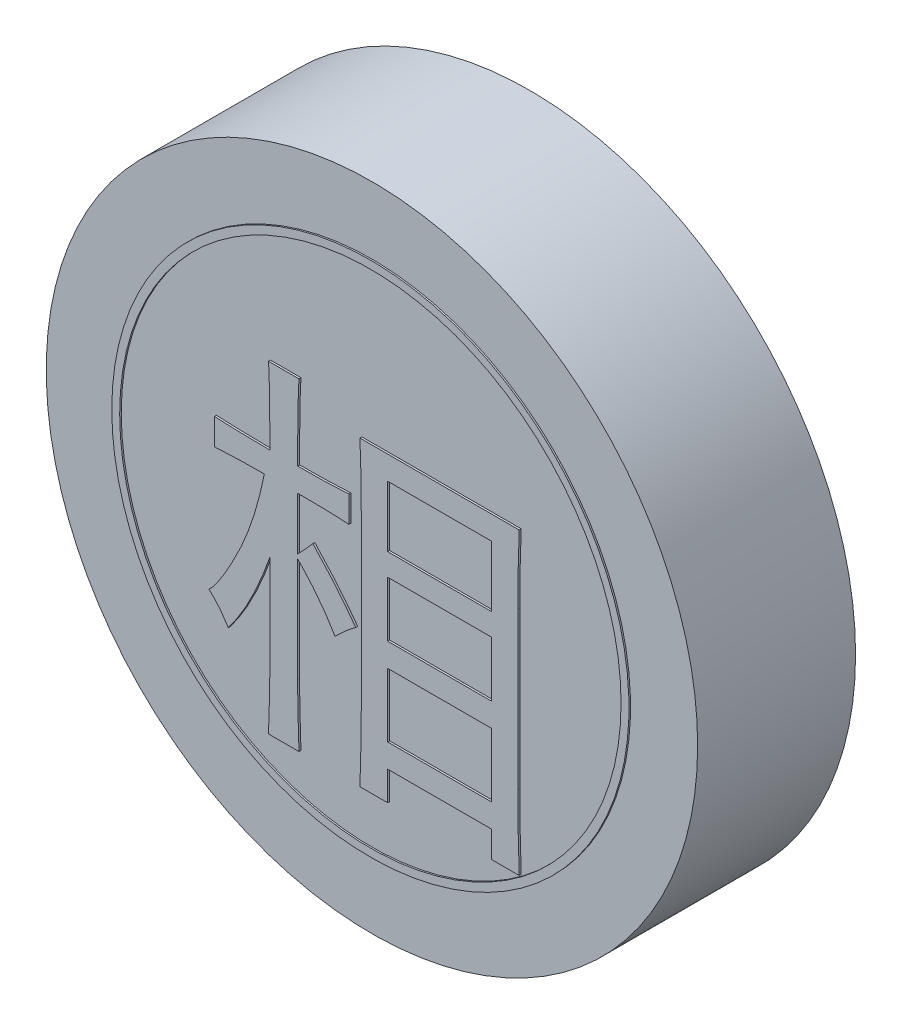
from build123d import *

# Parameters (mm, degrees)
SKETCH_1_R               = 16.5
DIAMETER33_HEIGHT8_DEPTH = 8
SKETCH_2_W               = 5.263157895
SKETCH_2_H               = 3.228070175
SKETCH_2_H_2             = 3.087719298
SKETCH_2_H_3             = 2.807017544
CHARACTER_DEPTH          = 0.1
SKETCH_3_R               = 13.1
SKETCH_3_R_2             = 12.7
INK_RING_DEPTH           = 0.08


with BuildPart() as part:
    # 草图1 → Diameter33_Height8 (new body)
    with BuildSketch(Plane.XY):
        Circle(SKETCH_1_R)
    extrude(amount=-DIAMETER33_HEIGHT8_DEPTH)

    # 草图2 → Character_相 (add)
    # profile 1 of 2: a face of its own
    with BuildSketch(Plane.XY):
        with BuildLine():
            add(Edge.make_bspline(
                [(7.561403509, 5.043859649), (7.55019112, 4.760584697), (7.527530744, 4.188082503), (7.508340227, 3.319863454), (7.49462205, 2.433550242), (7.492367, 1.83658782), (7.49122807, 1.535087719)],
                knots=[0, 0, 0, 0, 0.969283805, 1.958934606, 2.969145462, 4, 4, 4, 4], degree=3))
            Line((7.49122807, 1.535087719), (7.49122807, -6.394736842))
            add(Edge.make_bspline(
                [(7.49122807, -6.394736842), (7.494373274, -7.020306568), (7.500608133, -8.260397781), (7.541259106, -9.499836795), (7.561403509, -10.114035088)],
                knots=[0, 0, 0, 0, 1.008909215, 2, 2, 2, 2], degree=3))
            Line((7.561403509, -10.114035088), (6.157894737, -10.114035088))
            Line((6.157894737, -10.114035088), (6.157894737, -8.780701754))
            Line((6.157894737, -8.780701754), (0.894736842, -8.780701754))
            Line((0.894736842, -8.780701754), (0.894736842, -10.254385965))
            Line((0.894736842, -10.254385965), (-0.50877193, -10.254385965))
            add(Edge.make_bspline(
                [(-0.50877193, -10.254385965), (-0.497692205, -9.914790058), (-0.476326497, -9.259926631), (-0.456441705, -8.312053821), (-0.44245572, -7.435279895), (-0.439845263, -6.873840554), (-0.438596491, -6.605263158)],
                knots=[0, 0, 0, 0, 1.117081682, 2.154136505, 3.116988825, 4, 4, 4, 4], degree=3))
            Line((-0.438596491, -6.605263158), (-0.438596491, 1.605263158))
            add(Edge.make_bspline(
                [(-0.438596491, 1.605263158), (-0.439728026, 1.905030661), (-0.441958496, 2.495929231), (-0.45560045, 3.368382891), (-0.474798879, 4.214949159), (-0.497552487, 4.770115799), (-0.50877193, 5.043859649)],
                knots=[0, 0, 0, 0, 1.04583296, 2.06153501, 3.044173712, 4, 4, 4, 4], degree=3))
            Line((-0.50877193, 5.043859649), (7.561403509, 5.043859649))
        make_face()
        with Locations((3.52631579, -5.973684211)):
            Rectangle(SKETCH_2_W, SKETCH_2_H, mode=Mode.SUBTRACT)
        with Locations((3.52631579, 2.307017544)):
            Rectangle(SKETCH_2_W, SKETCH_2_H_2, mode=Mode.SUBTRACT)
        with Locations((3.52631579, -1.763157895)):
            Rectangle(SKETCH_2_W, SKETCH_2_H_3, mode=Mode.SUBTRACT)
    # profile 2 of 2: a face of its own
    with BuildSketch(Plane.XY):
        with BuildLine():
            add(Edge.make_bspline(
                [(-5.070175439, 2.236842105), (-5.069643134, 2.466430588), (-5.068622699, 2.906554508), (-5.075570455, 3.53725376), (-5.079714917, 4.10907054), (-5.087055031, 4.62111986), (-5.098673186, 5.0733128), (-5.106736303, 5.466792434), (-5.12325681, 5.801143721), (-5.135036136, 6.004664303), (-5.140350877, 6.096491228)],
                knots=[0, 0, 0, 0, 1.427178642, 2.735918853, 3.920795363, 4.981877593, 5.919216055, 6.732723881, 7.428214742, 8, 8, 8, 8], degree=3))
            Line((-5.140350877, 6.096491228), (-3.596491228, 6.096491228))
            add(Edge.make_bspline(
                [(-3.596491228, 6.096491228), (-3.601779492, 5.999464476), (-3.613344956, 5.787266417), (-3.630069425, 5.441663603), (-3.638095211, 5.041255673), (-3.649732329, 4.586464135), (-3.657106974, 4.077015184), (-3.661264203, 3.512129116), (-3.668208495, 2.892692888), (-3.667194182, 2.461232429), (-3.666666667, 2.236842105)],
                knots=[0, 0, 0, 0, 0.604055621, 1.321073082, 2.150740011, 3.093471638, 4.149178994, 5.317910599, 6.605121521, 8, 8, 8, 8], degree=3))
            add(Edge.make_bspline(
                [(-3.666666667, 2.236842105), (-3.530644111, 2.236328112), (-3.266384763, 2.235329545), (-2.88174296, 2.242348317), (-2.520442081, 2.246480446), (-2.183393026, 2.253960205), (-1.870707533, 2.265624871), (-1.582020196, 2.273807132), (-1.317912922, 2.290824228), (-1.149878443, 2.301807771), (-1.070175439, 2.307017544)],
                knots=[0, 0, 0, 0, 1.256536578, 2.441150545, 3.553740755, 4.59446206, 5.555405596, 6.444361595, 7.262121348, 8, 8, 8, 8], degree=3))
            Line((-1.070175439, 2.307017544), (-1.070175439, 0.973684211))
            add(Edge.make_bspline(
                [(-1.070175439, 0.973684211), (-1.144677854, 0.978928331), (-1.304031085, 0.990144981), (-1.556887974, 1.006935749), (-1.839513589, 1.015234756), (-2.149605268, 1.026721716), (-2.488385884, 1.034270902), (-2.855751381, 1.03840672), (-3.251657288, 1.045376401), (-3.525446035, 1.044375774), (-3.666666667, 1.043859649)],
                knots=[0, 0, 0, 0, 0.689951739, 1.475737907, 2.340680501, 3.301602752, 4.342301003, 5.470871417, 6.695471813, 8, 8, 8, 8], degree=3))
            Line((-3.666666667, 1.043859649), (-3.666666667, -1.622807018))
            add(Edge.make_bspline(
                [(-3.666666667, -1.622807018), (-3.606636203, -1.561535904), (-3.48182972, -1.434150045), (-3.293392102, -1.23182095), (-3.094864807, -1.013455465), (-2.962807273, -0.859869327), (-2.894736842, -0.780701754)],
                knots=[0, 0, 0, 0, 0.900819035, 1.872850031, 2.903538413, 4, 4, 4, 4], degree=3))
            add(Edge.make_bspline(
                [(-2.894736842, -0.780701754), (-2.689573637, -1.00021337), (-2.288105654, -1.429758644), (-1.724253911, -2.085214095), (-1.199061827, -2.727559357), (-0.877018772, -3.163628299), (-0.719298246, -3.377192982)],
                knots=[0, 0, 0, 0, 1.063555414, 2.081189198, 3.060262768, 4, 4, 4, 4], degree=3))
            add(Edge.make_bspline(
                [(-0.719298246, -3.377192982), (-0.794679109, -3.429771468), (-0.958911081, -3.544323996), (-1.205171009, -3.756414434), (-1.484543132, -4.003739185), (-1.672408418, -4.190524428), (-1.771929825, -4.289473684)],
                knots=[0, 0, 0, 0, 0.790186824, 1.721576733, 2.793008042, 4, 4, 4, 4], degree=3))
            add(Edge.make_bspline(
                [(-1.771929825, -4.289473684), (-1.904998341, -4.0700807), (-2.172035646, -3.629810433), (-2.627101337, -3.003052442), (-3.120200979, -2.3973547), (-3.483629338, -2.022250893), (-3.666666667, -1.833333333)],
                knots=[0, 0, 0, 0, 0.989574309, 1.98584356, 2.985588755, 4, 4, 4, 4], degree=3))
            Line((-3.666666667, -1.833333333), (-3.666666667, -7.166666667))
            add(Edge.make_bspline(
                [(-3.666666667, -7.166666667), (-3.66710265, -7.269767462), (-3.668003985, -7.48291384), (-3.66072287, -7.813831844), (-3.656774838, -8.166472041), (-3.648756785, -8.54161481), (-3.637317912, -8.938358747), (-3.628857904, -9.357787252), (-3.611274705, -9.798652569), (-3.601493913, -10.100167122), (-3.596491228, -10.254385965)],
                knots=[0, 0, 0, 0, 0.801096895, 1.65615505, 2.571793352, 3.541398262, 4.571731919, 5.655903347, 6.80104005, 8, 8, 8, 8], degree=3))
            Line((-3.596491228, -10.254385965), (-5.140350877, -10.254385965))
            add(Edge.make_bspline(
                [(-5.140350877, -10.254385965), (-5.135369022, -10.10016635), (-5.125684865, -9.80038102), (-5.107972861, -9.362986873), (-5.099566341, -8.949620037), (-5.088128806, -8.560674404), (-5.080093207, -8.195928707), (-5.076127742, -7.855416847), (-5.068855811, -7.538361954), (-5.069746959, -7.334744801), (-5.070175439, -7.236842105)],
                knots=[0, 0, 0, 0, 1.22682853, 2.384814657, 3.480414063, 4.514038807, 5.478633795, 6.38111711, 7.221612736, 8, 8, 8, 8], degree=3))
            Line((-5.070175439, -7.236842105), (-5.070175439, -2.464912281))
            add(Edge.make_bspline(
                [(-5.070175439, -2.464912281), (-5.145846519, -2.675980137), (-5.294332566, -3.090149346), (-5.536827031, -3.689408015), (-5.785768752, -4.257890313), (-6.045384746, -4.792645481), (-6.312844256, -5.294903161), (-6.587960306, -5.764116531), (-6.873615691, -6.199513832), (-7.076236773, -6.471903257), (-7.175438596, -6.605263158)],
                knots=[0, 0, 0, 0, 1.153721074, 2.263896326, 3.325849438, 4.34673122, 5.322030602, 6.253316748, 7.144836456, 8, 8, 8, 8], degree=3))
            add(Edge.make_bspline(
                [(-7.175438596, -6.605263158), (-7.255029914, -6.482647166), (-7.407975598, -6.247023641), (-7.657596365, -5.928969858), (-7.897823334, -5.645524257), (-8.073840549, -5.487664221), (-8.157894737, -5.412280702)],
                knots=[0, 0, 0, 0, 1.130515109, 2.172440566, 3.127278412, 4, 4, 4, 4], degree=3))
            add(Edge.make_bspline(
                [(-8.157894737, -5.412280702), (-8.113720781, -5.370641152), (-8.01581978, -5.278357058), (-7.875116797, -5.106371966), (-7.717691149, -4.894771662), (-7.55214221, -4.637411783), (-7.368626266, -4.340225536), (-7.17523642, -3.999537296), (-6.966943261, -3.616722912), (-6.748324508, -3.195711401), (-6.527564492, -2.742508267), (-6.321130463, -2.262276924), (-6.126625974, -1.76162537), (-5.940007338, -1.243020266), (-5.775804486, -0.699655792), (-5.619811727, -0.137450112), (-5.476041057, 0.445727539), (-5.392993233, 0.842595842), (-5.350877193, 1.043859649)],
                knots=[0, 0, 0, 0, 0.40920384, 0.906902363, 1.496106211, 2.188358286, 2.970301714, 3.852632424, 4.830874076, 5.910586812, 7.053030269, 8.231162496, 9.436019769, 10.676532886, 11.948579996, 13.264574909, 14.612783986, 16, 16, 16, 16], degree=3))
            add(Edge.make_bspline(
                [(-5.350877193, 1.043859649), (-5.59606702, 1.042803509), (-6.063956973, 1.040788102), (-6.730227869, 1.027390075), (-7.327421009, 1.009098406), (-7.701367224, 0.985010229), (-7.877192982, 0.973684211)],
                knots=[0, 0, 0, 0, 1.163979785, 2.221195127, 3.163623796, 4, 4, 4, 4], degree=3))
            Line((-7.877192982, 0.973684211), (-7.877192982, 2.307017544))
            add(Edge.make_bspline(
                [(-7.877192982, 2.307017544), (-7.660637158, 2.295769666), (-7.216421348, 2.272697163), (-6.531817674, 2.253723458), (-5.812703734, 2.240131437), (-5.321428092, 2.237955131), (-5.070175439, 2.236842105)],
                knots=[0, 0, 0, 0, 0.926596032, 1.900704393, 2.926359164, 4, 4, 4, 4], degree=3))
        make_face()
    extrude(amount=CHARACTER_DEPTH)

    # 草图3 → Ink_ring (add)
    with BuildSketch(Plane.XY):
        with Locations(Location((0, 0, 0), (0, 0, 180))):
            Circle(SKETCH_3_R)
        with Locations(Location((0, 0, 0), (0, 0, 180))):
            Circle(SKETCH_3_R_2, mode=Mode.SUBTRACT)
    extrude(amount=INK_RING_DEPTH)


solid = part.part
